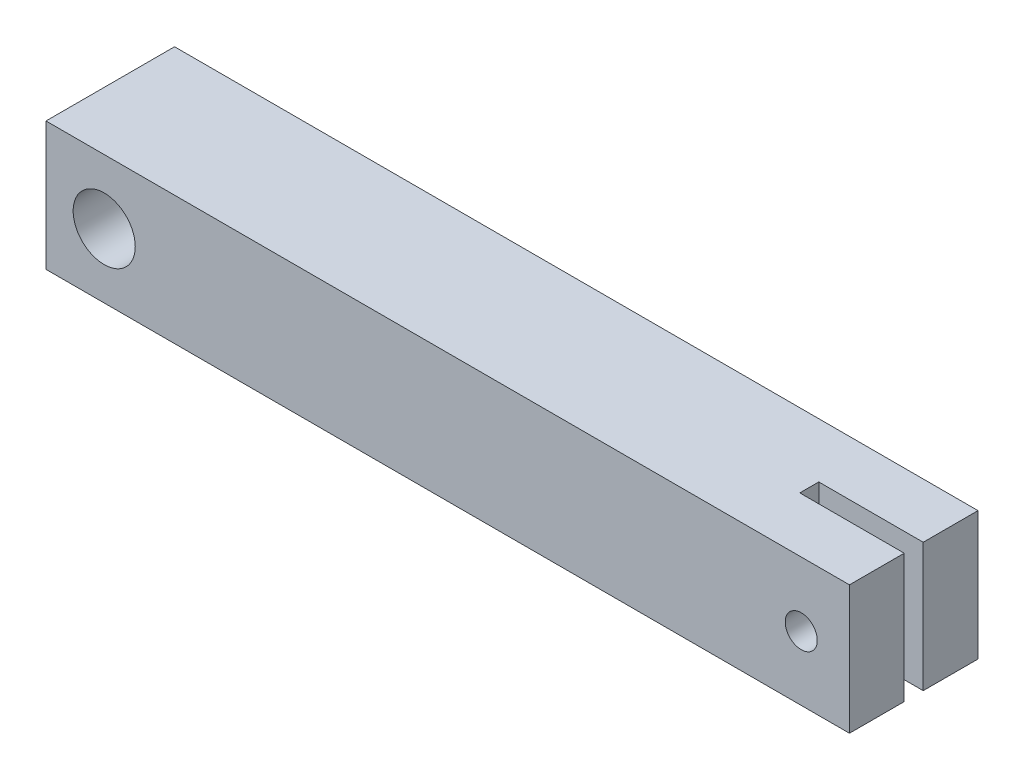
from build123d import *

# Parameters (mm, degrees)
CROQUIS1_W              = 50
CROQUIS1_H              = 8
CROQUIS1_R              = 1.932766006
CROQUIS1_R_2            = 0.996557478
SALIENTE_EXTRUIR1_DEPTH = 4
CROQUIS2_W              = 13
CROQUIS2_H              = 1.180512064
CORTAR_EXTRUIR1_DEPTH   = 27.551836095


with BuildPart() as part:
    # Croquis1 → Saliente-Extruir1 (new, symmetric)
    with BuildSketch(Plane.XY):
        Rectangle(CROQUIS1_W, CROQUIS1_H)
        with Locations((-21.377815108, 0)):
            Circle(CROQUIS1_R, mode=Mode.SUBTRACT)
        with Locations((22, 0)):
            Circle(CROQUIS1_R_2, mode=Mode.SUBTRACT)
    extrude(amount=SALIENTE_EXTRUIR1_DEPTH, both=True)

    # Croquis2 → Cortar-Extruir1 (cut, through all)
    with BuildSketch(Plane(origin=(0, 4, 0), x_dir=(1, 0, 0), z_dir=(0, 1, 0))):
        with Locations((25, 0)):
            Rectangle(CROQUIS2_W, CROQUIS2_H)
    extrude(amount=-CORTAR_EXTRUIR1_DEPTH, mode=Mode.SUBTRACT)


solid = part.part
